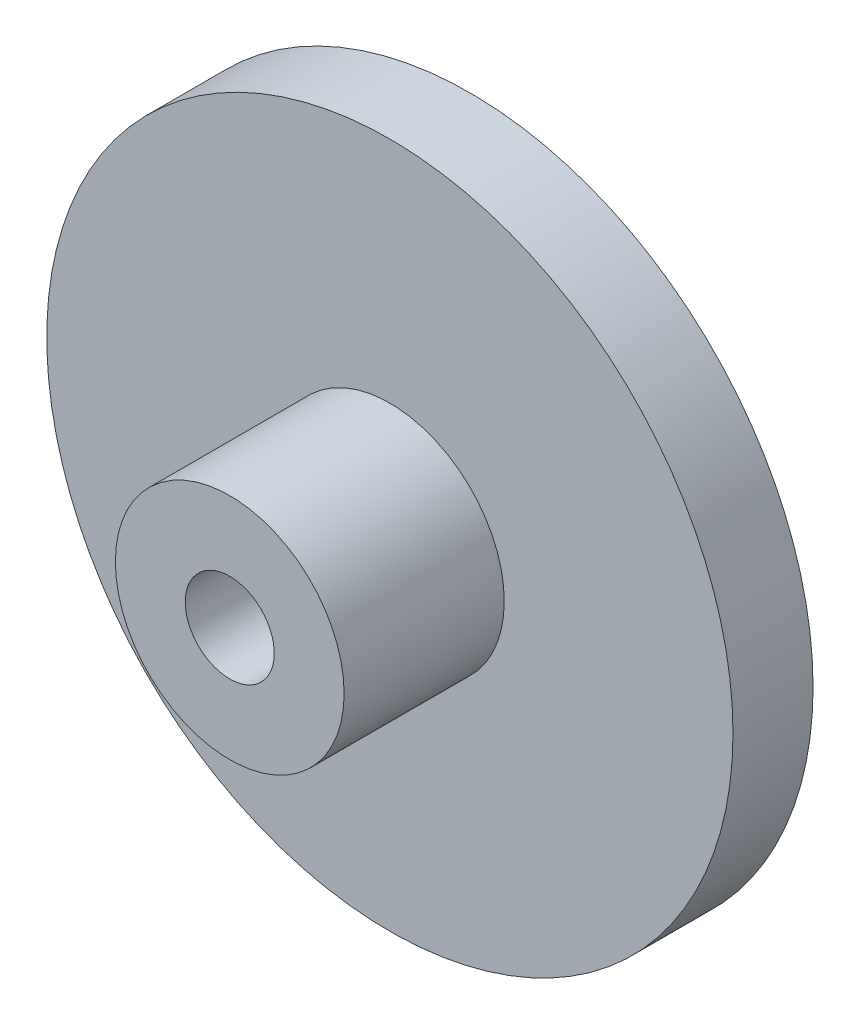
from build123d import *

# Parameters (mm, degrees)
CROQUIS1_R              = 15
SALIENTE_EXTRUIR1_DEPTH = 3.5
CROQUIS2_R              = 5
SALIENTE_EXTRUIR2_DEPTH = 7
CROQUIS3_R              = 1.945
CORTAR_EXTRUIR1_DEPTH   = 24.669600757


with BuildPart() as part:
    # Croquis1 → Saliente-Extruir1 (new body)
    with BuildSketch(Plane.XY):
        Circle(CROQUIS1_R)
    extrude(amount=SALIENTE_EXTRUIR1_DEPTH)

    # Croquis2 → Saliente-Extruir2 (add)
    with BuildSketch(Plane.XY.offset(3.5)):
        Circle(CROQUIS2_R)
    extrude(amount=SALIENTE_EXTRUIR2_DEPTH)

    # Croquis3 → Cortar-Extruir1 (cut, through all)
    with BuildSketch(Plane(origin=(0, 0, 0), x_dir=(-1, 0, 0), z_dir=(0, 0, -1))):
        Circle(CROQUIS3_R)
    extrude(amount=-CORTAR_EXTRUIR1_DEPTH, mode=Mode.SUBTRACT)


solid = part.part
